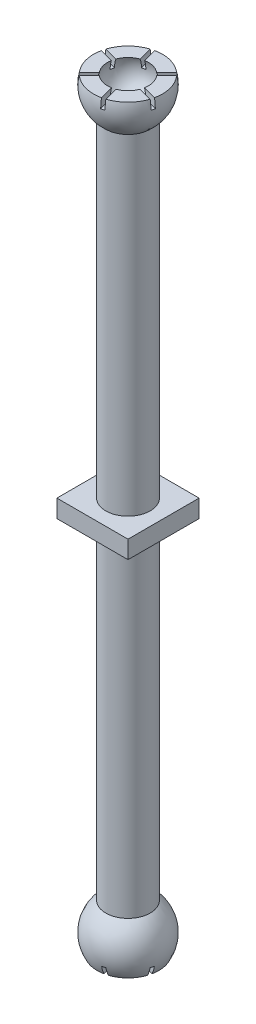
from build123d import *

# Parameters (mm, degrees)
SKETCH1_R           = 25
BOSS_EXTRUDE1_DEPTH = 826
SKETCH4_R           = 43.933657467
CUT_EXTRUDE1_DEPTH  = 838.911689858
SKETCH6_R           = 44.273508254
CUT_EXTRUDE2_DEPTH  = 888.804032431
CUT_EXTRUDE3_DEPTH  = 868.845608389
CUT_EXTRUDE4_DEPTH  = 848.889143697
SKETCH11_W          = 80
SKETCH11_H          = 80
BOSS_EXTRUDE2_DEPTH = 10


with BuildPart() as part:
    # Sketch1 → Boss-Extrude1 (new body)
    with BuildSketch(Plane(origin=(0, 0, 0), x_dir=(1, 0, 0), z_dir=(0, 1, 0))):
        with Locations(Location((0, 0, 0), (0, 0, 90))):
            Circle(SKETCH1_R)
    extrude(amount=BOSS_EXTRUDE1_DEPTH)

    # Sketch2 → Revolve1 (revolve)
    with BuildSketch(Plane(origin=(0, 826, 0), x_dir=(1, 0, 0), z_dir=(0, 1, 0))):
        with BuildLine():
            Line((0, 40), (0, -40))
            ThreePointArc((0, -40), (-40, 0), (0, 40))
        make_face()
    revolve(axis=Axis((0, 826, -40), (0, 0, 1)))

    # Sketch4 → Cut-Extrude1 (cut, through all)
    with BuildSketch(Plane(origin=(0, 836, 0), x_dir=(1, 0, 0), z_dir=(0, 1, 0))):
        Circle(SKETCH4_R)
    extrude(amount=CUT_EXTRUDE1_DEPTH, mode=Mode.SUBTRACT)

    # Sketch3 → Revolve3 (revolve)
    with BuildSketch(Plane.XZ):
        with BuildLine():
            Line((0, 40), (0, -40))
            ThreePointArc((0, -40), (40, 0), (0, 40))
        make_face()
    revolve(axis=Axis((0, 0, 40), (0, 0, -1)))

    # Sketch6 → Cut-Extrude2 (cut, through all)
    with BuildSketch(Plane(origin=(0, -20, 0), x_dir=(-1, 0, 0), z_dir=(0, -1, 0))):
        Circle(SKETCH6_R)
    extrude(amount=CUT_EXTRUDE2_DEPTH, mode=Mode.SUBTRACT)

    # Sketch8 → Cut-Extrude3 (cut, through all)
    with BuildSketch(Plane(origin=(0, 826, 0), x_dir=(1, 0, 0), z_dir=(0, 1, 0))):
        with BuildLine():
            Line((1.03527618, 3.863703305), (-9.473334967, 43.082374025))
            ThreePointArc((-9.473334967, 43.082374025), (-11.41692739, 42.608553085), (-13.337038272, 42.047097844))
            Line((-13.337038272, 42.047097844), (-2.828427125, 2.828427125))
            Line((-2.828427125, 2.828427125), (-42.047097844, 13.337038272))
            ThreePointArc((-42.047097844, 13.337038272), (-42.608553085, 11.41692739), (-43.082374025, 9.473334967))
            Line((-43.082374025, 9.473334967), (-3.863703305, -1.03527618))
            Line((-3.863703305, -1.03527618), (-32.573762877, -29.745335753))
            ThreePointArc((-32.573762877, -29.745335753), (-31.191625695, -31.191625695), (-29.745335753, -32.573762877))
            Line((-29.745335753, -32.573762877), (-1.03527618, -3.863703305))
            Line((-1.03527618, -3.863703305), (9.473334967, -43.082374025))
            ThreePointArc((9.473334967, -43.082374025), (11.41692739, -42.608553085), (13.337038272, -42.047097844))
            Line((13.337038272, -42.047097844), (2.828427125, -2.828427125))
            Line((2.828427125, -2.828427125), (42.047097844, -13.337038272))
            ThreePointArc((42.047097844, -13.337038272), (42.608553085, -11.41692739), (43.082374025, -9.473334967))
            Line((43.082374025, -9.473334967), (3.863703305, 1.03527618))
            Line((3.863703305, 1.03527618), (32.573762877, 29.745335753))
            ThreePointArc((32.573762877, 29.745335753), (31.191625695, 31.191625695), (29.745335753, 32.573762877))
            Line((29.745335753, 32.573762877), (1.03527618, 3.863703305))
        make_face()
    extrude(amount=CUT_EXTRUDE3_DEPTH, mode=Mode.SUBTRACT)

    # Sketch7 → Cut-Revolve1 (revolve, cut)
    with BuildSketch(Plane(origin=(0, 826, 0), x_dir=(1, 0, 0), z_dir=(0, 1, 0))):
        with BuildLine():
            Line((14.267321333, 20.52909014), (-14.267321333, -20.52909014))
            ThreePointArc((-14.267321333, -20.52909014), (-20.52909014, 14.267321333), (14.267321333, 20.52909014))
        make_face()
    revolve(axis=Axis((14.267321333, 826, -20.52909014), (-0.5706928533171581, 0, 0.8211636056065323)), mode=Mode.SUBTRACT)

    # Sketch9 → Cut-Revolve2 (revolve, cut)
    with BuildSketch(Plane(origin=(0, -10, 0), x_dir=(-1, 0, 0), z_dir=(0, -1, 0))):
        with BuildLine():
            Line((17.193616198, 18.148817098), (-17.193616198, -18.148817098))
            ThreePointArc((-17.193616198, -18.148817098), (-18.148817098, 17.193616198), (17.193616198, 18.148817098))
        make_face()
    revolve(axis=Axis((-17.193616198, -10, -18.148817098), (0.6877446479107123, 0, 0.7259526839058937)), mode=Mode.SUBTRACT)

    # Sketch10 → Cut-Extrude4 (cut, through all)
    with BuildSketch(Plane(origin=(0, -10, 0), x_dir=(-1, 0, 0), z_dir=(0, -1, 0))):
        with BuildLine():
            Line((-1.03527618, 3.863703305), (-29.745335753, 32.573762877))
            ThreePointArc((-29.745335753, 32.573762877), (-31.191625695, 31.191625695), (-32.573762877, 29.745335753))
            Line((-32.573762877, 29.745335753), (-3.863703305, 1.03527618))
            Line((-3.863703305, 1.03527618), (-43.082374025, -9.473334967))
            ThreePointArc((-43.082374025, -9.473334967), (-42.608553085, -11.41692739), (-42.047097844, -13.337038272))
            Line((-42.047097844, -13.337038272), (-2.828427125, -2.828427125))
            Line((-2.828427125, -2.828427125), (-13.337038272, -42.047097844))
            ThreePointArc((-13.337038272, -42.047097844), (-11.41692739, -42.608553085), (-9.473334967, -43.082374025))
            Line((-9.473334967, -43.082374025), (1.03527618, -3.863703305))
            Line((1.03527618, -3.863703305), (29.745335753, -32.573762877))
            ThreePointArc((29.745335753, -32.573762877), (31.191625695, -31.191625695), (32.573762877, -29.745335753))
            Line((32.573762877, -29.745335753), (3.863703305, -1.03527618))
            Line((3.863703305, -1.03527618), (43.082374025, 9.473334967))
            ThreePointArc((43.082374025, 9.473334967), (42.608553085, 11.41692739), (42.047097844, 13.337038272))
            Line((42.047097844, 13.337038272), (2.828427125, 2.828427125))
            Line((2.828427125, 2.828427125), (13.337038272, 42.047097844))
            ThreePointArc((13.337038272, 42.047097844), (11.41692739, 42.608553085), (9.473334967, 43.082374025))
            Line((9.473334967, 43.082374025), (-1.03527618, 3.863703305))
        make_face()
    extrude(amount=CUT_EXTRUDE4_DEPTH, mode=Mode.SUBTRACT)

    # Sketch11 → Boss-Extrude2 (add, symmetric)
    with BuildSketch(Plane(origin=(0, 413, 0), x_dir=(1, 0, 0), z_dir=(0, 1, 0))):
        Rectangle(SKETCH11_W, SKETCH11_H)
    extrude(amount=BOSS_EXTRUDE2_DEPTH, both=True)


solid = part.part
